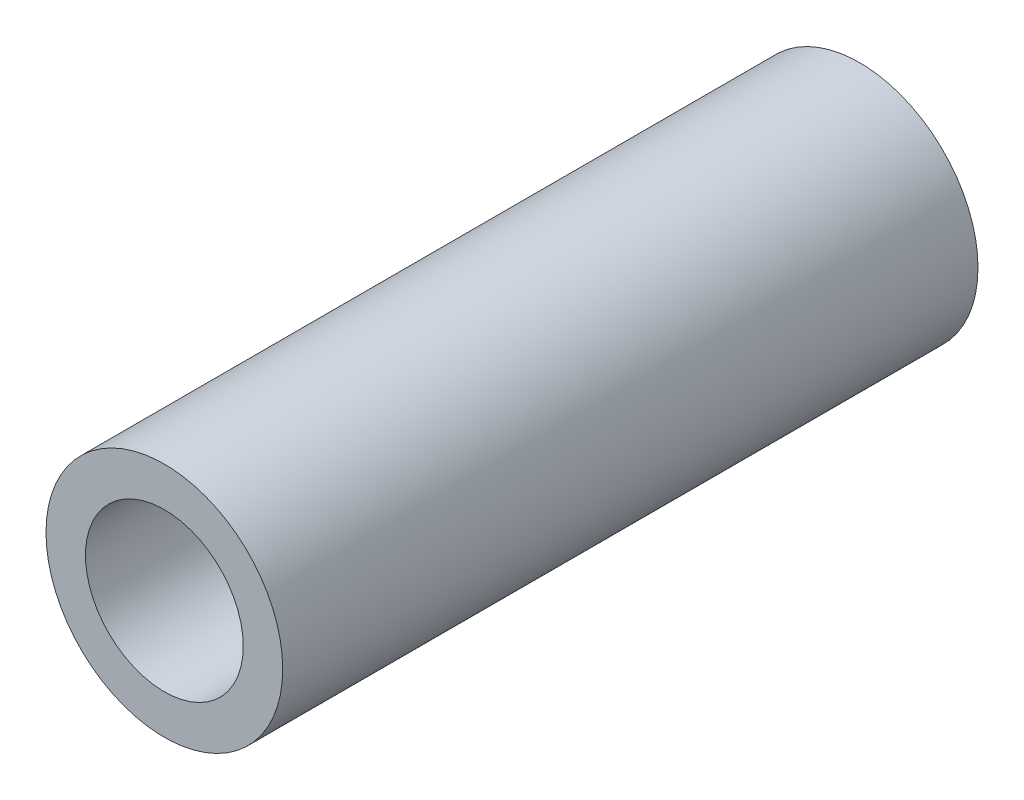
from build123d import *

# Parameters (mm, degrees)
SKETCH_1_R      = 0.6
SKETCH_1_R_2    = 0.4
EXTRUDE_1_DEPTH = 3.524907


with BuildPart() as part:
    # Эскиз1 → Бобышка-Вытянуть1 (new body)
    with BuildSketch(Plane.XY):
        with Locations((3.5, -0.424264069)):
            Circle(SKETCH_1_R)
        with Locations((3.5, -0.424264069)):
            Circle(SKETCH_1_R_2, mode=Mode.SUBTRACT)
    extrude(amount=EXTRUDE_1_DEPTH)


solid = part.part
